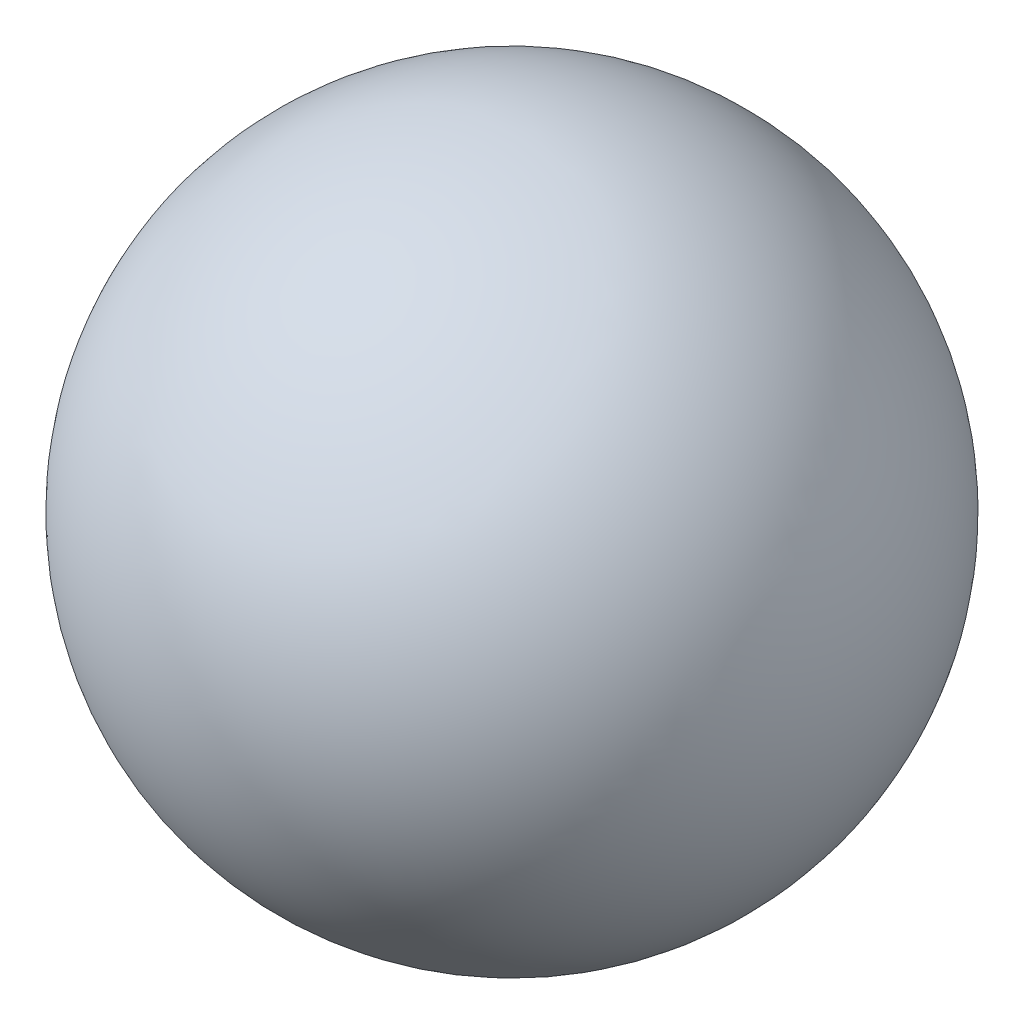
from build123d import *

# Parameters (mm, degrees)
SCALE1_SCALE = 1.41361111


with BuildPart() as part:
    # Sketch1 → Revolve1 (revolve)
    with BuildSketch(Plane.XY):
        with BuildLine():
            Line((-12, 0), (12, 0))
            ThreePointArc((12, 0), (0, -12), (-12, 0))
        make_face()
    revolve(axis=Axis((-12, 0, 0), (1, 0, 0)))


with BuildPart() as part_1:
    # Scale1: scaled about (0, 0, 0)
    add(part.part.scale(SCALE1_SCALE))


solid = part_1.part
